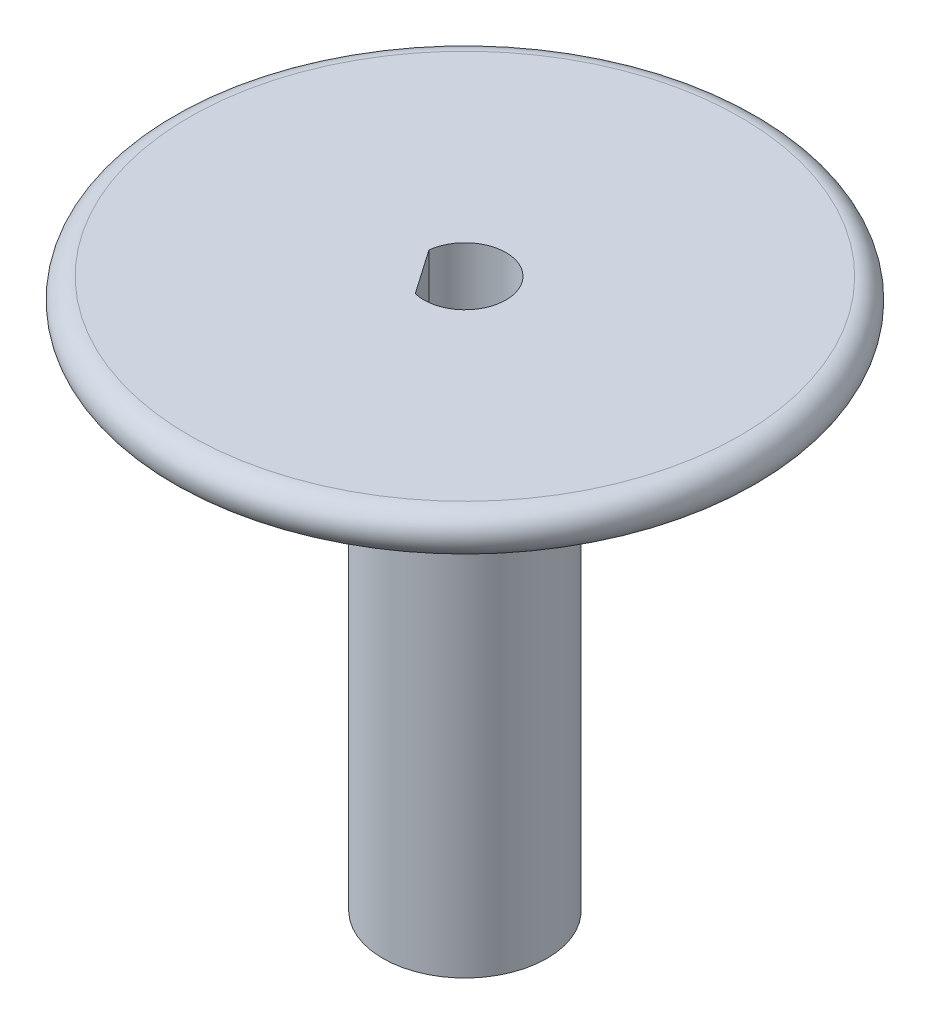
from build123d import *

# Parameters (mm, degrees)
CUT_EXTRUDE1_DEPTH = 43.728464961


with BuildPart() as part:
    # Sketch1 → Revolve1 (revolve)
    with BuildSketch(Plane.XY):
        with BuildLine():
            Line((0, -15.723376421), (0, 18.263376421))
            Line((0, 18.263376421), (17.041503786, 18.263376421))
            ThreePointArc((17.041503786, 18.263376421), (18.311503786, 16.993376421), (17.041503786, 15.723376421))
            Line((17.041503786, 15.723376421), (5.08, 15.723376421))
            Line((5.08, 15.723376421), (5.08, -15.723376421))
            Line((5.08, -15.723376421), (0, -15.723376421))
        make_face()
    revolve(axis=Axis((0, -15.723376421, 0), (0, 1, 0)))

    # Sketch2 → Cut-Extrude1 (cut, through all)
    with BuildSketch(Plane(origin=(0, 18.263376421, 0), x_dir=(1, 0, 0), z_dir=(0, 1, 0))):
        with BuildLine():
            Line((-0.604738857, -2.466959853), (-2.522366538, 0.298775913))
            ThreePointArc((-2.522366538, 0.298775913), (2.087347748, 1.447266174), (-0.604738857, -2.466959853))
        make_face()
    extrude(amount=-CUT_EXTRUDE1_DEPTH, mode=Mode.SUBTRACT)


solid = part.part
